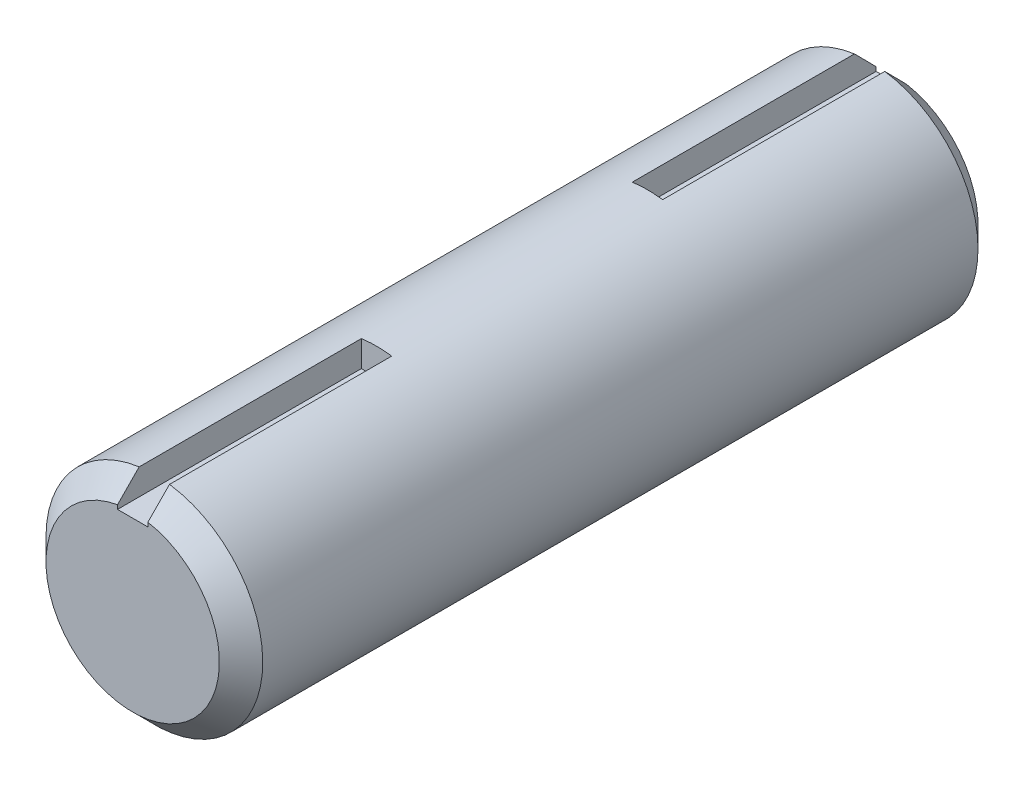
from build123d import *

# Parameters (mm, degrees)
SKETCH1_R      = 12.7
EXTRUDE1_DEPTH = 88.9
SKETCH2_W      = 3.556
SKETCH2_H      = 3.175
EXTRUDE2_DEPTH = 28.575
CHAMFER1_SIZE  = 2.54
CHAMFER2_SIZE  = 2.54


with BuildPart() as part:
    # Sketch1 → Extrude1 (new body)
    with BuildSketch(Plane.XY):
        Circle(SKETCH1_R)
    extrude(amount=-EXTRUDE1_DEPTH)

    # Sketch2 → Extrude2 (cut)
    with BuildSketch(Plane.XY):
        with Locations((0, 11.1125)):
            Rectangle(SKETCH2_W, SKETCH2_H)
    extrude2 = extrude(amount=-EXTRUDE2_DEPTH, mode=Mode.SUBTRACT)

    # Chamfer1
    chamfer1_edges = [part.edges().sort_by_distance(p)[0] for p in [
        (-8.327946926, -9.588289733, 0),
    ]]
    chamfer(chamfer1_edges, length=CHAMFER1_SIZE)

    # Mirror5: Extrude2 across plane
    add(extrude2.mirror(Plane.XY.offset(-44.45)), mode=Mode.SUBTRACT)

    # Chamfer2
    chamfer2_edges = [part.edges().sort_by_distance(p)[0] for p in [
        (-8.327946926, -9.588289733, -88.9),
    ]]
    chamfer(chamfer2_edges, length=CHAMFER2_SIZE)


solid = part.part
